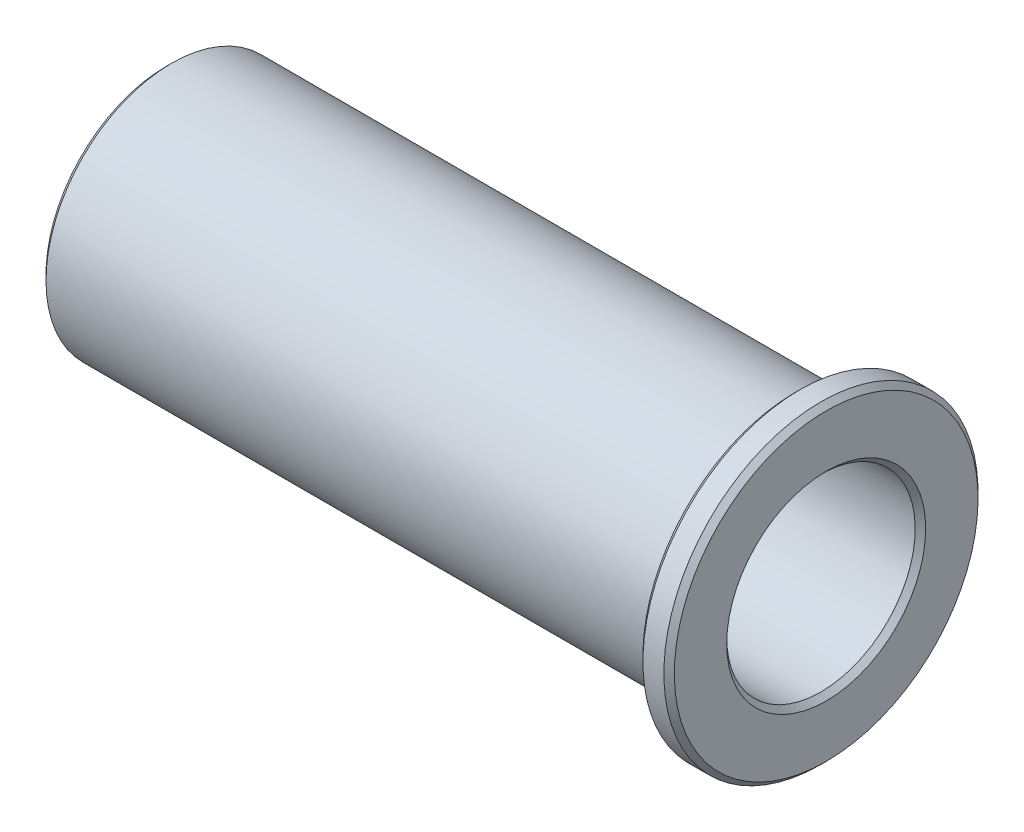
from build123d import *

# Parameters (mm, degrees)
CHAMFER_1_SIZE = 0.5


with BuildPart() as part:
    # Эскиз1 → Повернуть1 (revolve)
    with BuildSketch(Plane.XY, mode=Mode.PRIVATE) as revolve_1_sk:
        Polygon((0, 9), (0, 12), (60, 12), (60, 15), (63, 15), (63, 9), align=None)
    revolve(revolve_1_sk.sketch.rotate(Axis((0, 0, 0), (1, 0, 0)), 180), axis=Axis((0, 0, 0), (1, 0, 0)))

    # Фаска1
    chamfer_1_edges = [part.edges().sort_by_distance(p)[0] for p in [
        (60, 15, 0),
        (0, 12, 0),
        (0, 9, 0),
        (63, 9, 0),
        (63, 15, 0),
    ]]
    chamfer(chamfer_1_edges, length=CHAMFER_1_SIZE)


solid = part.part
